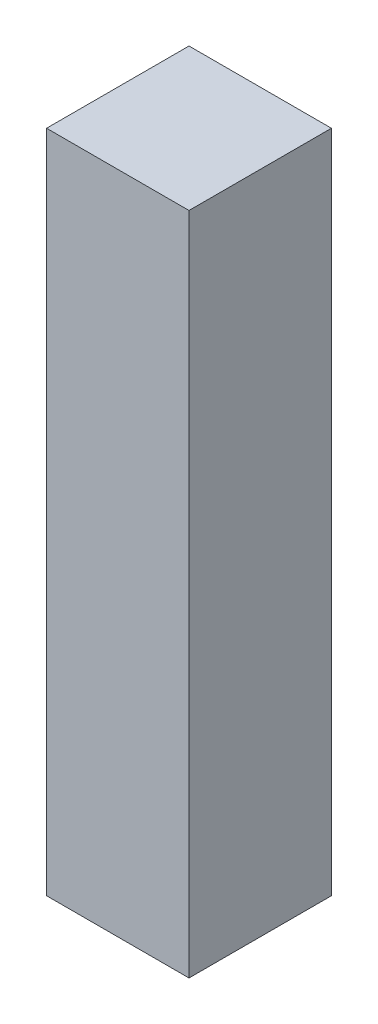
from build123d import *

# Parameters (mm, degrees)
SKETCH1_W           = 15
SKETCH1_H           = 15
BOSS_EXTRUDE1_DEPTH = 70


with BuildPart() as part:
    # Sketch1 → Boss-Extrude1 (new body)
    with BuildSketch(Plane(origin=(0, 0, 0), x_dir=(1, 0, 0), z_dir=(0, 1, 0))):
        with Locations((7.5, 7.5)):
            Rectangle(SKETCH1_W, SKETCH1_H)
    extrude(amount=BOSS_EXTRUDE1_DEPTH)


solid = part.part
